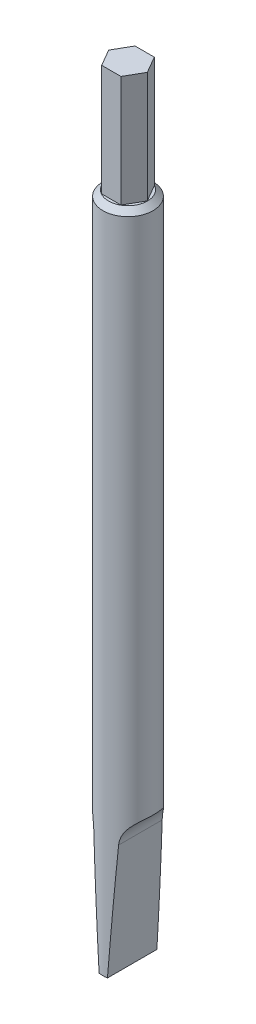
from build123d import *

# Parameters (mm, degrees)
BOSS_EXTRUDE1_DEPTH     = 20
SKETCH1_3_R             = 4.5
BOSS_EXTRUDE2_DEPTH     = 120
CHAMFER1_SIZE           = 1
CUT_EXTRUDE1_DEPTH      = 121.168631514
CUT_EXTRUDE1_DEPTH_BACK = 121.168631514


with BuildPart() as part:
    # Sketch1 → Boss-Extrude1 (new body)
    with BuildSketch(Plane(origin=(0, 0, 0), x_dir=(1, 0, 0), z_dir=(0, 1, 0))):
        Polygon((1.732050808, -3), (3.464101615, 0), (1.732050808, 3), (-1.732050808, 3), (-3.464101615, 0), (-1.732050808, -3), align=None)
    extrude(amount=BOSS_EXTRUDE1_DEPTH)

    # Sketch1<3> → Boss-Extrude2 (add)
    with BuildSketch(Plane(origin=(0, 0, 0), x_dir=(1, 0, 0), z_dir=(0, 1, 0))):
        Circle(SKETCH1_3_R)
    extrude(amount=-BOSS_EXTRUDE2_DEPTH)

    # Chamfer1
    chamfer1_edges = [part.edges().sort_by_distance(p)[0] for p in [
        (-4.5, 0, 0),
    ]]
    chamfer(chamfer1_edges, length=CHAMFER1_SIZE)

    # Sketch2 → Cut-Extrude1 (cut, two sides: drawn at the far end of the back side and taken through both)
    with BuildSketch(Plane.XY.offset(-CUT_EXTRUDE1_DEPTH_BACK)):
        with BuildLine():
            Line((0.75, -120), (2.229044758, -98.848674543))
            ThreePointArc((2.229044758, -98.848674543), (2.910634909, -96.656515683), (4.5, -95))
            Line((4.5, -95), (4.5, -120))
            Line((4.5, -120), (0.75, -120))
        make_face()
        with BuildLine():
            Line((-4.5, -120), (-0.75, -120))
            Line((-0.75, -120), (-2.229044758, -98.848674543))
            ThreePointArc((-2.229044758, -98.848674543), (-2.910634909, -96.656515683), (-4.5, -95))
            Line((-4.5, -95), (-4.5, -120))
        make_face()
    extrude(amount=CUT_EXTRUDE1_DEPTH + CUT_EXTRUDE1_DEPTH_BACK, mode=Mode.SUBTRACT)


solid = part.part
